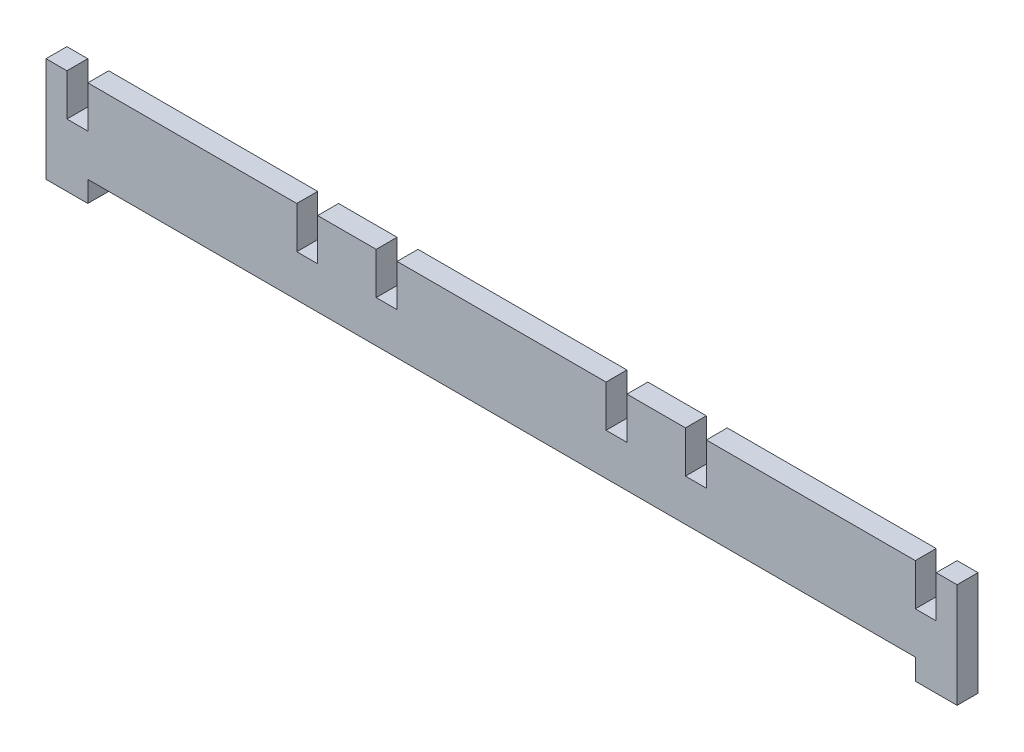
from build123d import *

# Parameters (mm, degrees)
BOSS_EXTRU_1_DEPTH = 5


with BuildPart() as part:
    # Esquisse1 → Boss.-Extru.1 (new body)
    with BuildSketch(Plane.XY):
        Polygon((-30, 0), (-30, -10), (-25, -10), (-25, 0), (25, 0), (25, -10), (30, -10), (30, 0), (44, 0), (44, -10), (49, -10), (49, 0), (99, 0), (99, -10), (104, -10), (104, 0), (109, 0), (109, -25), (99, -25), (99, -20), (-99, -20), (-99, -25), (-109, -25), (-109, 0), (-104, 0), (-104, -10), (-99, -10), (-99, 0), (-49, 0), (-49, -10), (-44, -10), (-44, 0), align=None)
    extrude(amount=BOSS_EXTRU_1_DEPTH)


solid = part.part
